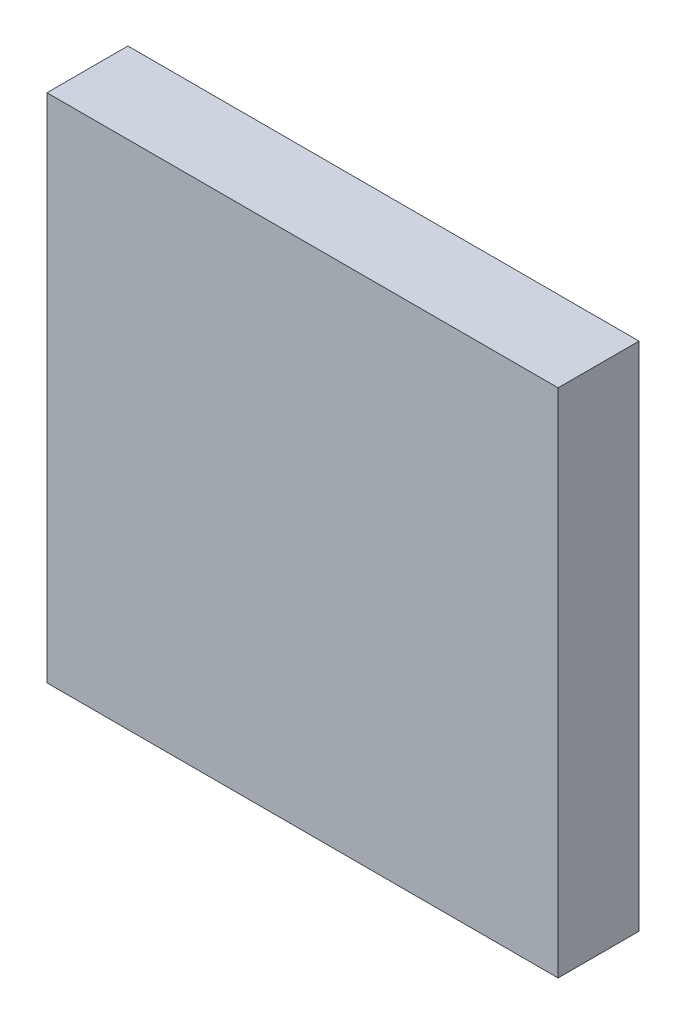
from build123d import *

# Parameters (mm, degrees)
SKETCH1_W           = 240
SKETCH1_H           = 240
BOSS_EXTRUDE1_DEPTH = 38


with BuildPart() as part:
    # Sketch1 → Boss-Extrude1 (new body)
    with BuildSketch(Plane.XY):
        with Locations((6.987341772, -23.088607595)):
            Rectangle(SKETCH1_W, SKETCH1_H)
    extrude(amount=BOSS_EXTRUDE1_DEPTH)


solid = part.part
